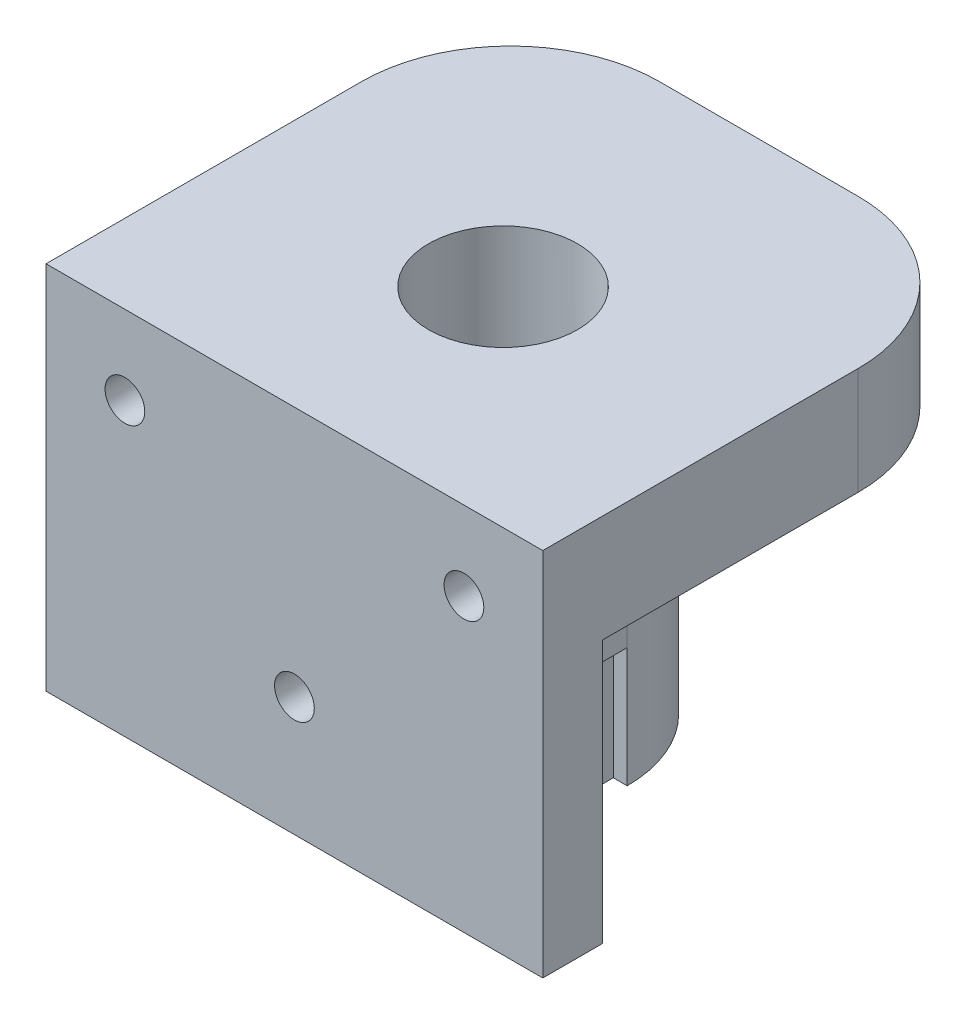
from build123d import *

# Parameters (mm, degrees)
PROFILE_SKETCH1_R                              = 7.5
PROFILE_BOSS_EXTRUDE2_DEPTH                    = 37.25987
FASTENINGHOLESKETCH3_R                         = 2
FASTENINGHOLECUT_EXTRUDE8_DEPTH                = 56.995963358
LM8UUFASTENINGHOLESKETCH5_R                    = 2
LM8UUFASTENINGHOLECUT_EXTRUDE9_DEPTH           = 56.995963425
YAXISMICROSWITCHCUT_EXTRUDE1_DEPTH             = 12.05
MICROSWITCHMOUNTINGHOLESKETCH2_R               = 1.5
YAXISMICROSWITCHMOUNTINGHOLECUT_EXTRUDE2_DEPTH = 3.1
TOPKNOTCHSKETCH2_W                             = 50
TOPKNOTCHSKETCH2_H                             = 27.5
TOPKNOTCHCUT_EXTRUDE1_DEPTH                    = 10.8
TOPSHELFSKETCH3_W                              = 50
TOPSHELFSKETCH3_H                              = 10.8
TOPSHELFBOSS_EXTRUDE1_DEPTH                    = 40.75
TOPSHELFLM8UUHOLESKETCH_R                      = 7.5
TOPSHELFLM8UUCUT_EXTRUDE2_DEPTH                = 52.733552168
XAXISMICROSWITCHSKETCH7_W                      = 12.85
XAXISMICROSWITCHSKETCH7_H                      = 12.05
XAXISMICROSWITCHCUT_EXTRUDE5_DEPTH             = 2.8
XAXISMICROSWITCHMOUNTINGHOLESKETCH8_R          = 1.5
XAXISMICROSWITCHMOUNTINGHOLECUT_EXTRUDE6_DEPTH = 3.1
FILLET3_R                                      = 15
FILLET4_R                                      = 15


with BuildPart() as part:
    # Profile-Sketch1 → Profile-Boss-Extrude2 (new body)
    with BuildSketch(Plane(origin=(0, 0, 0), x_dir=(1, 0, 0), z_dir=(0, 1, 0))):
        with BuildLine():
            Line((-25, -21), (25, -21))
            Line((25, -21), (25, -15))
            Line((25, -15), (22.5, -15))
            ThreePointArc((22.5, -15), (15.428932188, -12.071067812), (12.5, -5))
            Line((12.5, -5), (12.5, 0))
            ThreePointArc((12.5, 0), (0, 12.5), (-12.5, 0))
            Line((-12.5, 0), (-12.5, -5))
            ThreePointArc((-12.5, -5), (-15.428932188, -12.071067812), (-22.5, -15))
            Line((-22.5, -15), (-25, -15))
            Line((-25, -15), (-25, -21))
        make_face()
        with Locations(Location((0, 0, 0), (0, 0, 270))):
            Circle(PROFILE_SKETCH1_R, mode=Mode.SUBTRACT)
    extrude(amount=PROFILE_BOSS_EXTRUDE2_DEPTH)

    # FasteningHoleSketch3 → FasteningHoleCut-Extrude8 (cut, through all)
    with BuildSketch(Plane.XY.offset(21)):
        with Locations((-17.0625, 29.32237)):
            Circle(FASTENINGHOLESKETCH3_R)
        with Locations((17.0625, 29.32237)):
            Circle(FASTENINGHOLESKETCH3_R)
    extrude(amount=-FASTENINGHOLECUT_EXTRUDE8_DEPTH, mode=Mode.SUBTRACT)

    # LM8UUFasteningHoleSketch5 → LM8UUFasteningHoleCut-Extrude9 (cut, through all)
    with BuildSketch(Plane.XY.offset(21)):
        with Locations((0, 12)):
            Circle(LM8UUFASTENINGHOLESKETCH5_R)
    extrude(amount=-LM8UUFASTENINGHOLECUT_EXTRUDE9_DEPTH, mode=Mode.SUBTRACT)

    # Sketch1 → YAxisMicroSwitchCut-Extrude1 (cut)
    with BuildSketch(Plane.XZ):
        Polygon((13.9, 12.85), (16.363847734, 12.85), (13.9, 10.102940329), (13.9, 0), (11.1, 0), (11.1, 12.85), align=None)
    extrude(amount=-YAXISMICROSWITCHCUT_EXTRUDE1_DEPTH, mode=Mode.SUBTRACT)

    # MicroSwitchMountingHoleSketch2 → YAxisMicroSwitchMountingHoleCut-Extrude2 (cut)
    with BuildSketch(Plane(origin=(11.1, 0, 0), x_dir=(0, 0, -1), z_dir=(1, 0, 0))):
        with Locations((-9.6, 5.05)):
            Circle(MICROSWITCHMOUNTINGHOLESKETCH2_R)
        with Locations((-3.25, 5.05)):
            Circle(MICROSWITCHMOUNTINGHOLESKETCH2_R)
    extrude(amount=-YAXISMICROSWITCHMOUNTINGHOLECUT_EXTRUDE2_DEPTH, mode=Mode.SUBTRACT)

    # TopKnotchSketch2 → TopKnotchCut-Extrude1 (cut)
    with BuildSketch(Plane(origin=(0, 37.25987, 0), x_dir=(1, 0, 0), z_dir=(0, 1, 0))):
        with Locations((0, -1.25)):
            Rectangle(TOPKNOTCHSKETCH2_W, TOPKNOTCHSKETCH2_H)
    extrude(amount=-TOPKNOTCHCUT_EXTRUDE1_DEPTH, mode=Mode.SUBTRACT)

    # TopShelfSketch3 → TopShelfBoss-Extrude1 (add)
    with BuildSketch(Plane(origin=(0, 0, 15), x_dir=(-1, 0, 0), z_dir=(0, 0, -1))):
        with Locations((0, 31.85987)):
            Rectangle(TOPSHELFSKETCH3_W, TOPSHELFSKETCH3_H)
    extrude(amount=TOPSHELFBOSS_EXTRUDE1_DEPTH)

    # TopShelfLM8UUHoleSketch → TopShelfLM8UUCut-Extrude2 (cut, through all)
    with BuildSketch(Plane(origin=(0, 37.25987, 0), x_dir=(1, 0, 0), z_dir=(0, 1, 0))):
        with Locations(Location((0, 0, 0), (0, 0, 270))):
            Circle(TOPSHELFLM8UUHOLESKETCH_R)
    extrude(amount=-TOPSHELFLM8UUCUT_EXTRUDE2_DEPTH, mode=Mode.SUBTRACT)

    # XAxisMicroSwitchSketch7 → XAxisMicroSwitchCut-Extrude5 (cut)
    with BuildSketch(Plane.XZ.offset(-26.45987)):
        with Locations((0, -19.725)):
            Rectangle(XAXISMICROSWITCHSKETCH7_W, XAXISMICROSWITCHSKETCH7_H)
    extrude(amount=-XAXISMICROSWITCHCUT_EXTRUDE5_DEPTH, mode=Mode.SUBTRACT)

    # XAxisMicroSwitchMountingHoleSketch8 → XAxisMicroSwitchMountingHoleCut-Extrude6 (cut)
    with BuildSketch(Plane.XZ.offset(-29.25987)):
        with Locations(Location((-3.175, -20.7, 0), (0, 0, 270))):
            Circle(XAXISMICROSWITCHMOUNTINGHOLESKETCH8_R)
        with Locations(Location((3.175, -20.7, 0), (0, 0, 270))):
            Circle(XAXISMICROSWITCHMOUNTINGHOLESKETCH8_R)
    extrude(amount=-XAXISMICROSWITCHMOUNTINGHOLECUT_EXTRUDE6_DEPTH, mode=Mode.SUBTRACT)

    # Fillet3
    fillet3_edges = [part.edges().sort_by_distance(p)[0] for p in [
        (25, 31.85987, -25.75),
    ]]
    fillet(fillet3_edges, radius=FILLET3_R)

    # Fillet4
    fillet4_edges = [part.edges().sort_by_distance(p)[0] for p in [
        (-25, 31.85987, -25.75),
    ]]
    fillet(fillet4_edges, radius=FILLET4_R)


solid = part.part
